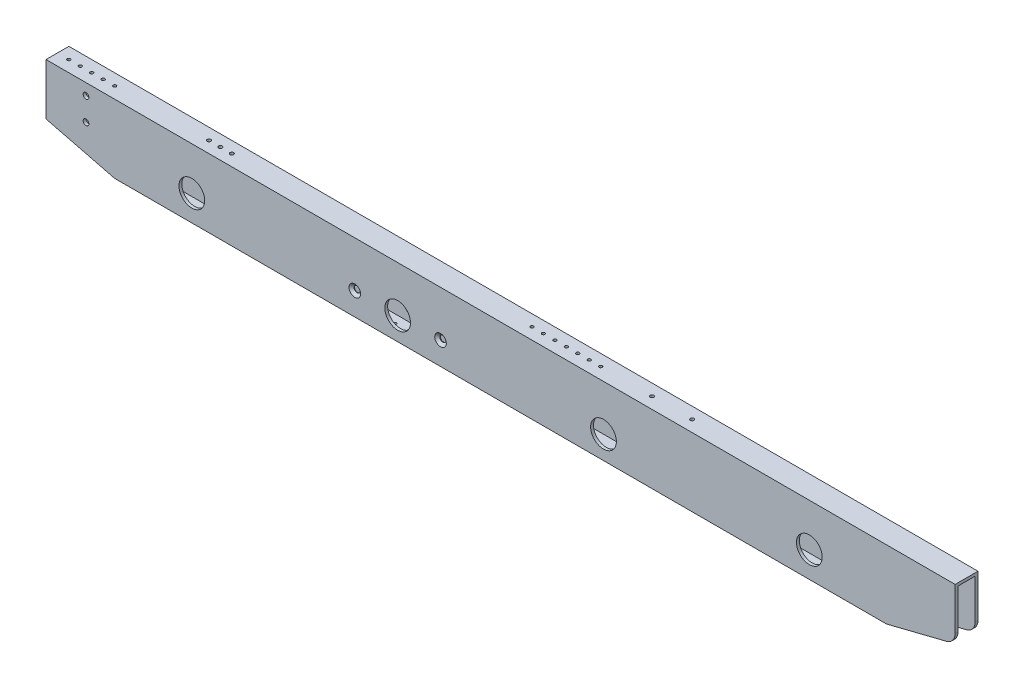
from build123d import *

# Parameters (mm, degrees)
SKETCH1_W                                           = 1009.65
SKETCH1_H                                           = 76.2
SKETCH1_R                                           = 14.2875
BOSS_EXTRUDE2_DEPTH                                 = 12.7
SKETCH3_W                                           = 19.05
SKETCH3_H                                           = 69.85
CUT_EXTRUDE2_DEPTH                                  = 1011.448426442
CUT_EXTRUDE3_DEPTH                                  = 507.897475457
FILLET1_R                                           = 12.7
SKETCH9_R                                           = 1.7272
CUT_EXTRUDE5_DEPTH                                  = 6.35
SKETCH12_R                                          = 1.7272
CUT_EXTRUDE8_DEPTH                                  = 5.08
CSK_FOR_1_4_FLAT_HEAD_MACHINE_SCREW_100_D           = 6.7564
CSK_FOR_1_4_FLAT_HEAD_MACHINE_SCREW_100_CSINK_D     = 12.8778
CSK_FOR_1_4_FLAT_HEAD_MACHINE_SCREW_100_CSINK_ANGLE = 100
CUT_EXTRUDE9_START                                  = -6.35
SKETCH15_R                                          = 1.7272
CUT_EXTRUDE9_DEPTH                                  = 6.35
SKETCH16_R                                          = 17.4625
CUT_EXTRUDE10_DEPTH                                 = 3.81
F_1_4_0_25_DIAMETER_HOLE1_D                         = 6.35
F_10_32_TAPPED_HOLE2_D                              = 4.0386
F_10_32_TAPPED_HOLE2_DEPTH                          = 13.716
F_10_32_TAPPED_HOLE2_TIP                            = 1.213317848
F_10_32_TAPPED_HOLE3_D                              = 4.0386


with BuildPart() as part:
    # Sketch1 → Boss-Extrude2 (new, symmetric)
    with BuildSketch(Plane.XY):
        Rectangle(SKETCH1_W, SKETCH1_H)
        with Locations((114.3, -12.7)):
            Circle(SKETCH1_R, mode=Mode.SUBTRACT)
        with Locations((-342.9, -9.525)):
            Circle(SKETCH1_R, mode=Mode.SUBTRACT)
        with Locations((342.9, -9.525)):
            Circle(SKETCH1_R, mode=Mode.SUBTRACT)
        with Locations((-114.3, -12.7)):
            Circle(SKETCH1_R, mode=Mode.SUBTRACT)
    extrude(amount=BOSS_EXTRUDE2_DEPTH, both=True)

    # Sketch3 → Cut-Extrude2 (cut, through all)
    with BuildSketch(Plane(origin=(504.825, 0, 0), x_dir=(0, 0, -1), z_dir=(1, 0, 0))):
        Rectangle(SKETCH3_W, SKETCH3_H)
    extrude(amount=-CUT_EXTRUDE2_DEPTH, mode=Mode.SUBTRACT)

    # Sketch4 → Cut-Extrude3 (cut, through all)
    with BuildSketch(Plane.XY.offset(12.7)):
        Polygon((-504.825, -38.1), (-504.825, -19.05), (-428.625, -38.1), align=None)
        Polygon((428.625, -38.1), (504.825, -38.1), (504.825, -19.05), align=None)
    extrude(amount=-CUT_EXTRUDE3_DEPTH, mode=Mode.SUBTRACT)

    # Fillet1
    fillet1_edges = [part.edges().sort_by_distance(p)[0] for p in [
        (504.825, -19.05, 11.1125),
        (504.825, -19.05, -11.1125),
    ]]
    fillet(fillet1_edges, radius=FILLET1_R)

    # Sketch9 → Cut-Extrude5 (cut)
    with BuildSketch(Plane(origin=(0, 38.1, 0), x_dir=(1, 0, 0), z_dir=(0, 1, 0))):
        with Locations(Location((-492.125, 0, 0), (0, 0, 270))):
            Circle(SKETCH9_R)
        with Locations(Location((-441.325, 0, 0), (0, 0, 270))):
            Circle(SKETCH9_R)
        with Locations(Location((-479.425, 0, 0), (0, 0, 270))):
            Circle(SKETCH9_R)
        with Locations(Location((-466.725, 0, 0), (0, 0, 270))):
            Circle(SKETCH9_R)
        with Locations(Location((-454.025, 0, 0), (0, 0, 270))):
            Circle(SKETCH9_R)
    extrude(amount=-CUT_EXTRUDE5_DEPTH, mode=Mode.SUBTRACT)

    # Sketch12 → Cut-Extrude8 (cut)
    with BuildSketch(Plane(origin=(0, 38.1, 0), x_dir=(1, 0, 0), z_dir=(0, 1, 0))):
        with Locations(Location((98.425, 0, 0), (0, 0, 270))):
            Circle(SKETCH12_R)
        with Locations(Location((85.725, 0, 0), (0, 0, 270))):
            Circle(SKETCH12_R)
        with Locations(Location((73.025, 0, 0), (0, 0, 270))):
            Circle(SKETCH12_R)
        with Locations(Location((60.325, 0, 0), (0, 0, 270))):
            Circle(SKETCH12_R)
        with Locations(Location((47.625, 0, 0), (0, 0, 270))):
            Circle(SKETCH12_R)
        with Locations(Location((34.925, 0, 0), (0, 0, 270))):
            Circle(SKETCH12_R)
        with Locations(Location((22.225, 0, 0), (0, 0, 270))):
            Circle(SKETCH12_R)
    extrude(amount=-CUT_EXTRUDE8_DEPTH, mode=Mode.SUBTRACT)

    # CSK for 1/4 Flat Head Machine Screw (100)1 (through all)
    with Locations(Plane.XY.offset(12.7)):
        with Locations((-66.675, -12.7), (-161.925, -12.7)):
            CounterSinkHole(CSK_FOR_1_4_FLAT_HEAD_MACHINE_SCREW_100_D / 2, CSK_FOR_1_4_FLAT_HEAD_MACHINE_SCREW_100_CSINK_D / 2, counter_sink_angle=CSK_FOR_1_4_FLAT_HEAD_MACHINE_SCREW_100_CSINK_ANGLE)

    # Sketch15 → Cut-Extrude9 (cut)
    with BuildSketch(Plane(origin=(0, -38.1, 0), x_dir=(-1, 0, 0), z_dir=(0, -1, 0)).offset(CUT_EXTRUDE9_START)):
        with Locations(Location((415.925, 0, 0), (0, 0, 180))):
            Circle(SKETCH15_R)
        with Locations(Location((396.875, 0, 0), (0, 0, 180))):
            Circle(SKETCH15_R)
        with Locations(Location((377.825, 0, 0), (0, 0, 180))):
            Circle(SKETCH15_R)
        with Locations(Location((358.775, 0, 0), (0, 0, 180))):
            Circle(SKETCH15_R)
        with Locations(Location((339.725, 0, 0), (0, 0, 180))):
            Circle(SKETCH15_R)
        with Locations(Location((320.675, 0, 0), (0, 0, 180))):
            Circle(SKETCH15_R)
        with Locations(Location((301.625, 0, 0), (0, 0, 180))):
            Circle(SKETCH15_R)
        with Locations(Location((282.575, 0, 0), (0, 0, 180))):
            Circle(SKETCH15_R)
        with Locations(Location((263.525, 0, 0), (0, 0, 180))):
            Circle(SKETCH15_R)
        with Locations(Location((244.475, 0, 0), (0, 0, 180))):
            Circle(SKETCH15_R)
        with Locations(Location((225.425, 0, 0), (0, 0, 180))):
            Circle(SKETCH15_R)
        with Locations(Location((206.375, 0, 0), (0, 0, 180))):
            Circle(SKETCH15_R)
        with Locations(Location((187.325, 0, 0), (0, 0, 180))):
            Circle(SKETCH15_R)
        with Locations(Location((168.275, 0, 0), (0, 0, 180))):
            Circle(SKETCH15_R)
        with Locations(Location((149.225, 0, 0), (0, 0, 180))):
            Circle(SKETCH15_R)
        with Locations(Location((130.175, 0, 0), (0, 0, 180))):
            Circle(SKETCH15_R)
        with Locations(Location((111.125, 0, 0), (0, 0, 180))):
            Circle(SKETCH15_R)
        with Locations(Location((92.075, 0, 0), (0, 0, 180))):
            Circle(SKETCH15_R)
        with Locations(Location((73.025, 0, 0), (0, 0, 180))):
            Circle(SKETCH15_R)
        with Locations(Location((53.975, 0, 0), (0, 0, 180))):
            Circle(SKETCH15_R)
        with Locations(Location((34.925, 0, 0), (0, 0, 180))):
            Circle(SKETCH15_R)
        with Locations(Location((15.875, 0, 0), (0, 0, 180))):
            Circle(SKETCH15_R)
        with Locations(Location((-3.175, 0, 0), (0, 0, 180))):
            Circle(SKETCH15_R)
        with Locations(Location((-22.225, 0, 0), (0, 0, 270))):
            Circle(SKETCH15_R)
        with Locations(Location((-41.275, 0, 0), (0, 0, 180))):
            Circle(SKETCH15_R)
        with Locations(Location((-60.325, 0, 0), (0, 0, 270))):
            Circle(SKETCH15_R)
    extrude(amount=CUT_EXTRUDE9_DEPTH, mode=Mode.SUBTRACT)

    # Sketch16 → Cut-Extrude10 (cut)
    with BuildSketch(Plane(origin=(0, 0, -12.7), x_dir=(-1, 0, 0), z_dir=(0, 0, -1))):
        with Locations((114.3, -12.7)):
            Circle(SKETCH16_R)
    extrude(amount=-CUT_EXTRUDE10_DEPTH, mode=Mode.SUBTRACT)

    # 1/4 (0.25) Diameter Hole1 (through all)
    with Locations(Plane.XY.offset(12.7)):
        with Locations((-460.375, 25.4), (-460.375, 0)):
            Hole(F_1_4_0_25_DIAMETER_HOLE1_D / 2)

    # #10-32 Tapped Hole2
    with Locations(Plane(origin=(0, 38.1, 0), x_dir=(1, 0, 0), z_dir=(0, 1, 0))):
        with Locations((155.575, 0), (200.025, 0)):
            Hole(F_10_32_TAPPED_HOLE2_D / 2, depth=F_10_32_TAPPED_HOLE2_DEPTH)
            with Locations((0, 0, -(F_10_32_TAPPED_HOLE2_DEPTH + F_10_32_TAPPED_HOLE2_TIP / 2))):  # 118° drill point
                Cone(0, F_10_32_TAPPED_HOLE2_D / 2, F_10_32_TAPPED_HOLE2_TIP, mode=Mode.SUBTRACT)

    # #10-32 Tapped Hole3 (through all)
    with Locations(Plane(origin=(0, 38.1, 0), x_dir=(1, 0, 0), z_dir=(0, 1, 0))):
        with Locations((-336.55, 0), (-311.15, 0), (-323.85, 0)):
            Hole(F_10_32_TAPPED_HOLE3_D / 2)


solid = part.part
